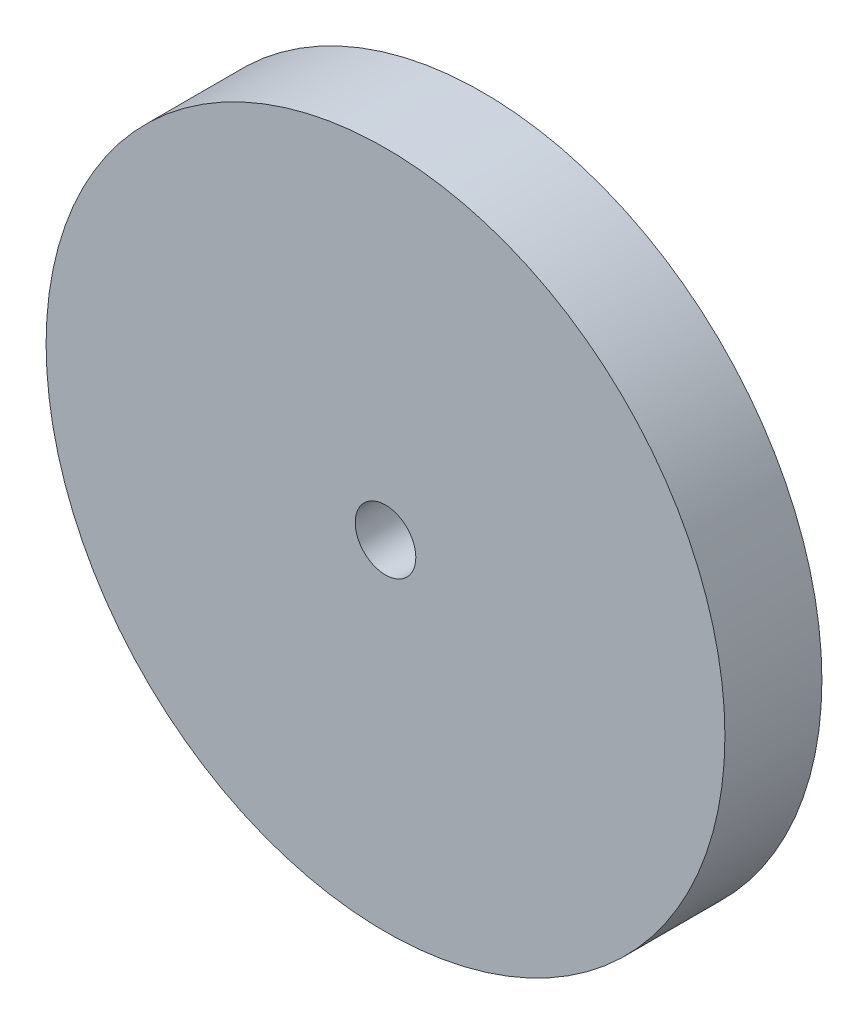
from build123d import *

# Parameters (mm, degrees)
SKETCH_1_R      = 140
SKETCH_1_R_2    = 12.5
EXTRUDE_1_DEPTH = 40


with BuildPart() as part:
    # 草图1 → 凸台-拉伸1 (new body)
    with BuildSketch(Plane.XY):
        Circle(SKETCH_1_R)
        Circle(SKETCH_1_R_2, mode=Mode.SUBTRACT)
    extrude(amount=EXTRUDE_1_DEPTH)


solid = part.part
